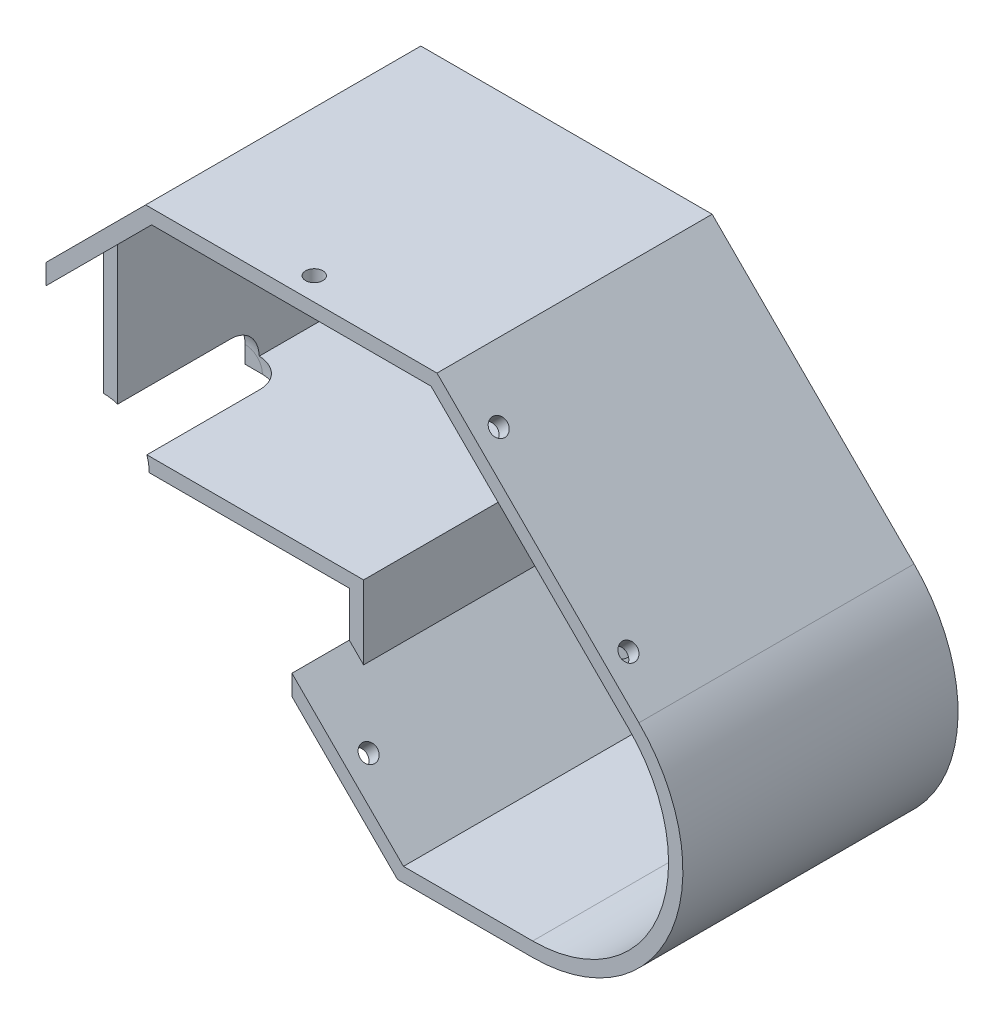
from build123d import *

# Parameters (mm, degrees)
RESSALTO_EXTRUS_O1_DEPTH = 48
ESBO_O12_R               = 1.5
CORTE_EXTRUS_O10_DEPTH   = 10
ESBO_O13_R               = 1.5
CORTE_EXTRUS_O11_DEPTH   = 10
ESBO_O14_R               = 1.5
CORTE_EXTRUS_O12_DEPTH   = 10
ESBO_O15_R               = 1.5
CORTE_EXTRUS_O13_DEPTH   = 10
CORTE_EXTRUS_O14_DEPTH   = 10
ESBO_O17_R               = 4
ESBO_O17_W               = 2.8
ESBO_O17_H               = 2.8
RESSALTO_EXTRUS_O2_DEPTH = 4
CORTE_EXTRUS_O15_DEPTH   = 10


with BuildPart() as part:
    # Model → Ressalto-extrusão1 (new body)
    with BuildSketch(Plane.XY):
        with BuildLine():
            Line((-0.7, 0), (39, 0))
            Line((39, 0), (39.7, 0))
            Line((39.7, 0), (39.7, -11.380317396))
            Line((39.7, -11.380317396), (50.182424304, -21.8627417))
            Line((50.182424304, -21.8627417), (58.119682605, -29.8))
            Line((58.119682605, -29.8), (81.7, -29.8))
            ThreePointArc((81.7, -29.8), (105.905643752, -13.626305928), (100.226197667, 14.926197667))
            Line((100.226197667, 14.926197667), (65.00338056, 50.149014774))
            Line((65.00338056, 50.149014774), (50.111140335, 50.149014774))
            Line((50.111140335, 50.149014774), (14.181595121, 50.149014774))
            Line((14.181595121, 50.149014774), (-3.2, 32.767419653))
            Line((-3.2, 32.767419653), (-3.2, 5))
            Line((-3.2, 5), (-3.2, 0))
            Line((-3.2, 0), (-0.7, 0))
        make_face()
        with BuildLine():
            Line((-0.7, 2.5), (39, 2.5))
            Line((39, 2.5), (39.7, 2.5))
            Line((39.7, 2.5), (42.2, 2.5))
            Line((42.2, 2.5), (42.2, -10.34478349))
            Line((42.2, -10.34478349), (51.950191257, -20.094974747))
            Line((51.950191257, -20.094974747), (59.15521651, -27.3))
            Line((59.15521651, -27.3), (81.7, -27.3))
            ThreePointArc((81.7, -27.3), (103.595944921, -12.669597347), (98.458430714, 13.158430714))
            Line((98.458430714, 13.158430714), (63.967846654, 47.649014774))
            Line((63.967846654, 47.649014774), (50.111140335, 47.649014774))
            Line((50.111140335, 47.649014774), (15.217129027, 47.649014774))
            Line((15.217129027, 47.649014774), (-0.7, 31.731885747))
            Line((-0.7, 31.731885747), (-0.7, 2.5))
        make_face(mode=Mode.SUBTRACT)
    extrude(amount=RESSALTO_EXTRUS_O1_DEPTH)

    # Esboço12 → Corte-extrusão10 (cut)
    with BuildSketch(Plane(origin=(57.576197667, 57.576197667, 0), x_dir=(0, 0, -1), z_dir=(0.7071067811865476, 0.7071067811865475, 0))):
        with Locations(Location((-44, -20.072657306, 0), (0, 0, 90))):
            Circle(ESBO_O12_R)
        with Locations(Location((-44, -52.072657306, 0), (0, 0, 90))):
            Circle(ESBO_O12_R)
    extrude(amount=-CORTE_EXTRUS_O10_DEPTH, mode=Mode.SUBTRACT)

    # Esboço13 → Corte-extrusão11 (cut)
    with BuildSketch(Plane(origin=(0, 50.149014774, 0), x_dir=(1, 0, 0), z_dir=(0, 1, 0))):
        with Locations(Location((39.59248784, -44, 0), (0, 0, 270))):
            Circle(ESBO_O13_R)
    extrude(amount=-CORTE_EXTRUS_O11_DEPTH, mode=Mode.SUBTRACT)

    # Esboço14 → Corte-extrusão12 (cut)
    with BuildSketch(Plane.ZY.offset(3.2)):
        with Locations((44, 23.701037279)):
            Circle(ESBO_O14_R)
        with Locations((44, 7.740898975)):
            Circle(ESBO_O14_R)
    extrude(amount=-CORTE_EXTRUS_O12_DEPTH, mode=Mode.SUBTRACT)

    # Esboço15 → Corte-extrusão13 (cut)
    with BuildSketch(Plane(origin=(14.159841302, 14.159841302, 0), x_dir=(0, 0, 1), z_dir=(-0.7071067811865477, -0.7071067811865475, 0))):
        with Locations(Location((44, -46.881179593, 0), (0, 0, 270))):
            Circle(ESBO_O15_R)
    extrude(amount=-CORTE_EXTRUS_O13_DEPTH, mode=Mode.SUBTRACT)

    # Esboço16 → Corte-extrusão14 (cut)
    with BuildSketch(Plane.XY.offset(48)):
        Polygon((39.7, 0), (39.7, -7.84478349), (42.2, -10.34478349), (42.2, 2.5), (-0.7, 2.5), (-0.7, 0), align=None)
    extrude(amount=-CORTE_EXTRUS_O14_DEPTH, mode=Mode.SUBTRACT)

    # Esboço17 → Ressalto-extrusão2 (add)
    # profile 1 of 6: a face of its own
    with BuildSketch(Plane(origin=(0, 0, 0), x_dir=(-1, 0, 0), z_dir=(0, 0, -1))):
        with Locations((-91.568699638, 17.926841447)):
            Circle(ESBO_O17_R)
        with Locations((-91.568699638, 17.926841447)):
            Rectangle(ESBO_O17_W, ESBO_O17_H, mode=Mode.SUBTRACT)
    # profile 2 of 6: a face of its own
    with BuildSketch(Plane(origin=(0, 0, 0), x_dir=(-1, 0, 0), z_dir=(0, 0, -1))):
        with Locations((-68.47265349, 41.022887595)):
            Circle(ESBO_O17_R)
        with Locations((-68.47265349, 41.022887595)):
            Rectangle(ESBO_O17_W, ESBO_O17_H, mode=Mode.SUBTRACT)
    # profile 3 of 6: a face of its own
    with BuildSketch(Plane(origin=(0, 0, 0), x_dir=(-1, 0, 0), z_dir=(0, 0, -1))):
        with Locations((-39.59248784, 46.149014774)):
            Circle(ESBO_O17_R)
        with Locations((-39.59248784, 46.149014774)):
            Rectangle(ESBO_O17_W, ESBO_O17_H, mode=Mode.SUBTRACT)
    # profile 4 of 6: a face of its own
    with BuildSketch(Plane(origin=(0, 0, 0), x_dir=(-1, 0, 0), z_dir=(0, 0, -1))):
        with Locations((-0.8, 24.383709827)):
            Circle(ESBO_O17_R)
        with Locations((-0.8, 24.383709827)):
            Rectangle(ESBO_O17_W, ESBO_O17_H, mode=Mode.SUBTRACT)
    # profile 5 of 6: a face of its own
    with BuildSketch(Plane(origin=(0, 0, 0), x_dir=(-1, 0, 0), z_dir=(0, 0, -1))):
        with Locations((-0.8, 8.383709827)):
            Circle(ESBO_O17_R)
        with Locations((-0.8, 8.383709827)):
            Rectangle(ESBO_O17_W, ESBO_O17_H, mode=Mode.SUBTRACT)
    # profile 6 of 6: a face of its own
    with BuildSketch(Plane(origin=(0, 0, 0), x_dir=(-1, 0, 0), z_dir=(0, 0, -1))):
        with Locations((-51.388268427, -17.411731573)):
            Circle(ESBO_O17_R)
        with Locations((-51.388268427, -17.411731573)):
            Rectangle(ESBO_O17_W, ESBO_O17_H, mode=Mode.SUBTRACT)
    extrude(amount=-RESSALTO_EXTRUS_O2_DEPTH)

    # Esboço18 → Corte-extrusão15 (cut)
    with BuildSketch(Plane.XY.offset(48)):
        Polygon((-0.7, 31.731885747), (-32.431885747, 0), (-0.7, 0), align=None)
    extrude(amount=-CORTE_EXTRUS_O15_DEPTH, mode=Mode.SUBTRACT)

    # Esboço19 → Corte-Revolução1 (revolve, cut)
    with BuildSketch(Plane.ZY.offset(3.2)):
        with BuildLine():
            Line((38.25689259, 0), (13.25689259, 0))
            Line((13.25689259, 0), (13.25689259, 3))
            ThreePointArc((13.25689259, 3), (14.721358684, 6.535533906), (18.25689259, 8))
            Line((18.25689259, 8), (38.25689259, 8))
            Line((38.25689259, 8), (38.25689259, 0))
        make_face()
    revolve(axis=Axis((-3.2, 0, 38.25689259), (0, 0, -1)), mode=Mode.SUBTRACT)


solid = part.part
